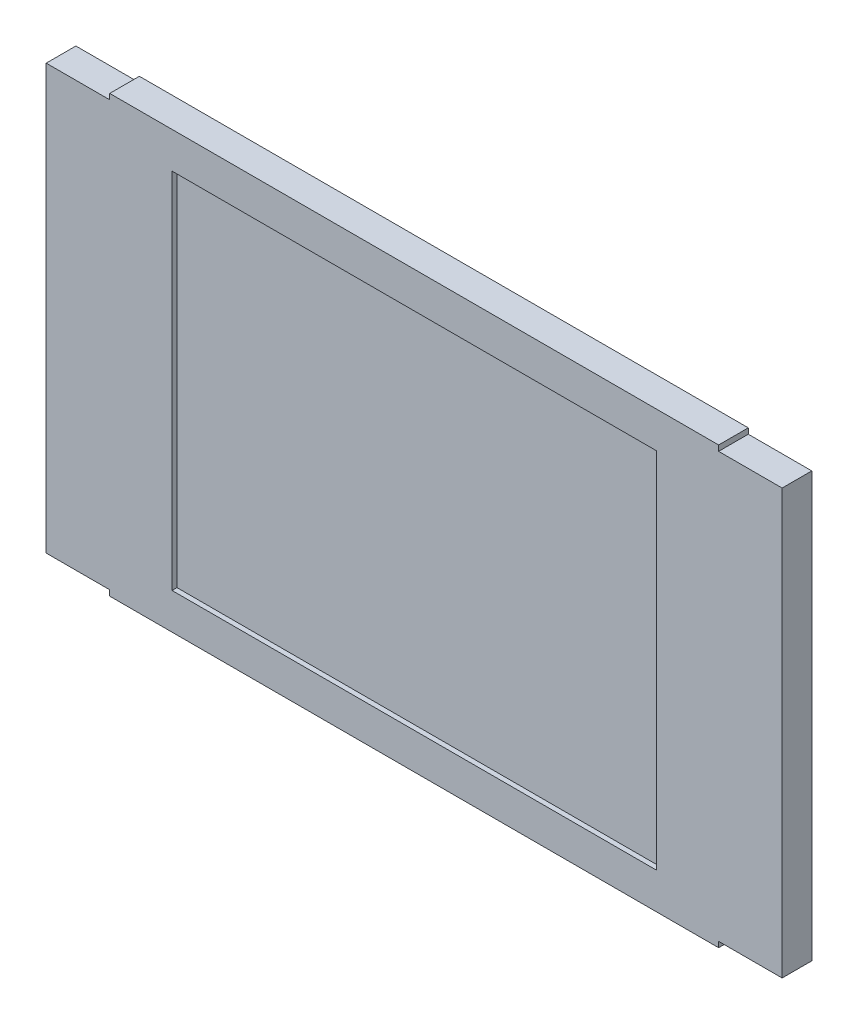
from build123d import *

# Parameters (mm, degrees)
SKETCH_1_W          = 74.4
SKETCH_1_H          = 42.9
EXTRUDE_1_DEPTH     = 3
SKETCH_2_W          = 61.56
SKETCH_2_H          = 44.02
EXTRUDE_2_DEPTH     = 3
SKETCH_3_W          = 48.96
SKETCH_3_H          = 36.72
CUT_EXTRUDE_2_DEPTH = 0.5


with BuildPart() as part:
    # 草图1 → 凸台-拉伸1 (new body)
    with BuildSketch(Plane.XY):
        Rectangle(SKETCH_1_W, SKETCH_1_H)
    extrude(amount=EXTRUDE_1_DEPTH)

    # 草图2 → 凸台-拉伸2 (add)
    with BuildSketch(Plane.XY.offset(3)):
        Rectangle(SKETCH_2_W, SKETCH_2_H)
    extrude(amount=-EXTRUDE_2_DEPTH)

    # 草图3 → 切除-拉伸2 (cut)
    with BuildSketch(Plane.XY.offset(3)):
        Rectangle(SKETCH_3_W, SKETCH_3_H)
    extrude(amount=-CUT_EXTRUDE_2_DEPTH, mode=Mode.SUBTRACT)


solid = part.part
